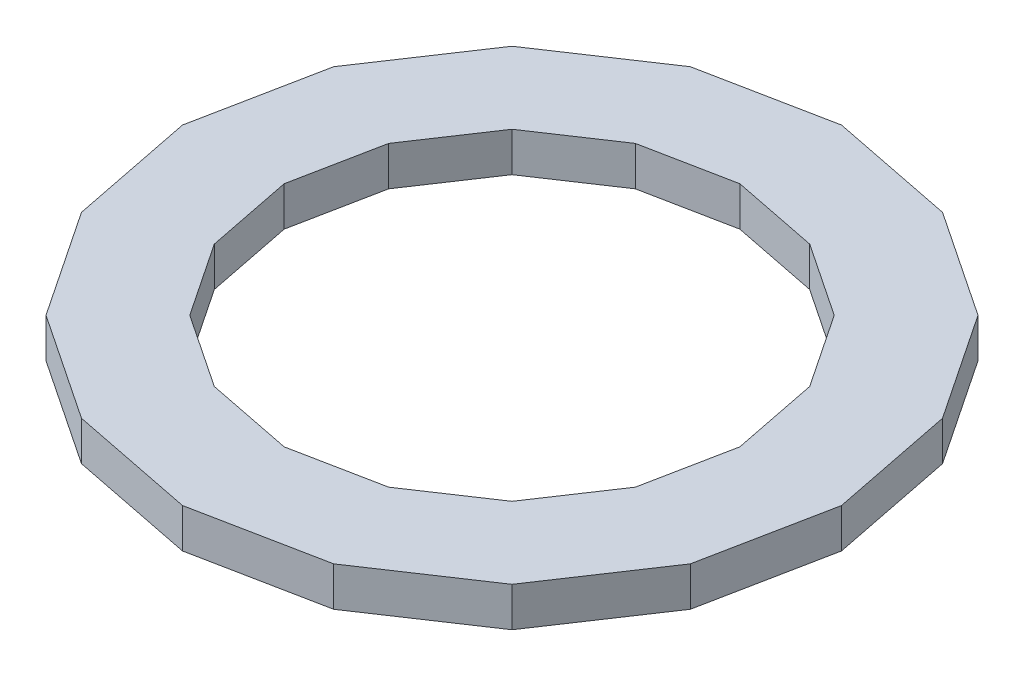
from build123d import *

# Parameters (mm, degrees)
BOSS_EXTRUDE1_DEPTH = 19.05


with BuildPart() as part:
    # Sketch1 → Boss-Extrude1 (new body)
    with BuildSketch(Plane(origin=(0, 0, 0), x_dir=(1, 0, 0), z_dir=(0, 1, 0))):
        Polygon((159.490228313, 0), (147.349757574, 61.034267999), (112.776621973, 112.776621973), (61.034267999, 147.349757574), (0, 159.490228313), (-61.034267999, 147.349757574), (-112.776621973, 112.776621973), (-147.349757574, 61.034267999), (-159.490228313, 0), (-147.349757574, -61.034267999), (-112.776621973, -112.776621973), (-61.034267999, -147.349757574), (0, -159.490228313), (61.034267999, -147.349757574), (112.776621973, -112.776621973), (147.349757574, -61.034267999), align=None)
        Polygon((110.284759018, 0), (101.889831605, 42.204150118), (77.983100963, 77.983100963), (42.204150118, 101.889831605), (0, 110.284759018), (-42.204150118, 101.889831605), (-77.983100963, 77.983100963), (-101.889831605, 42.204150118), (-110.284759018, 0), (-101.889831605, -42.204150118), (-77.983100963, -77.983100963), (-42.204150118, -101.889831605), (0, -110.284759018), (42.204150118, -101.889831605), (77.983100963, -77.983100963), (101.889831605, -42.204150118), align=None, mode=Mode.SUBTRACT)
    extrude(amount=BOSS_EXTRUDE1_DEPTH)


solid = part.part
